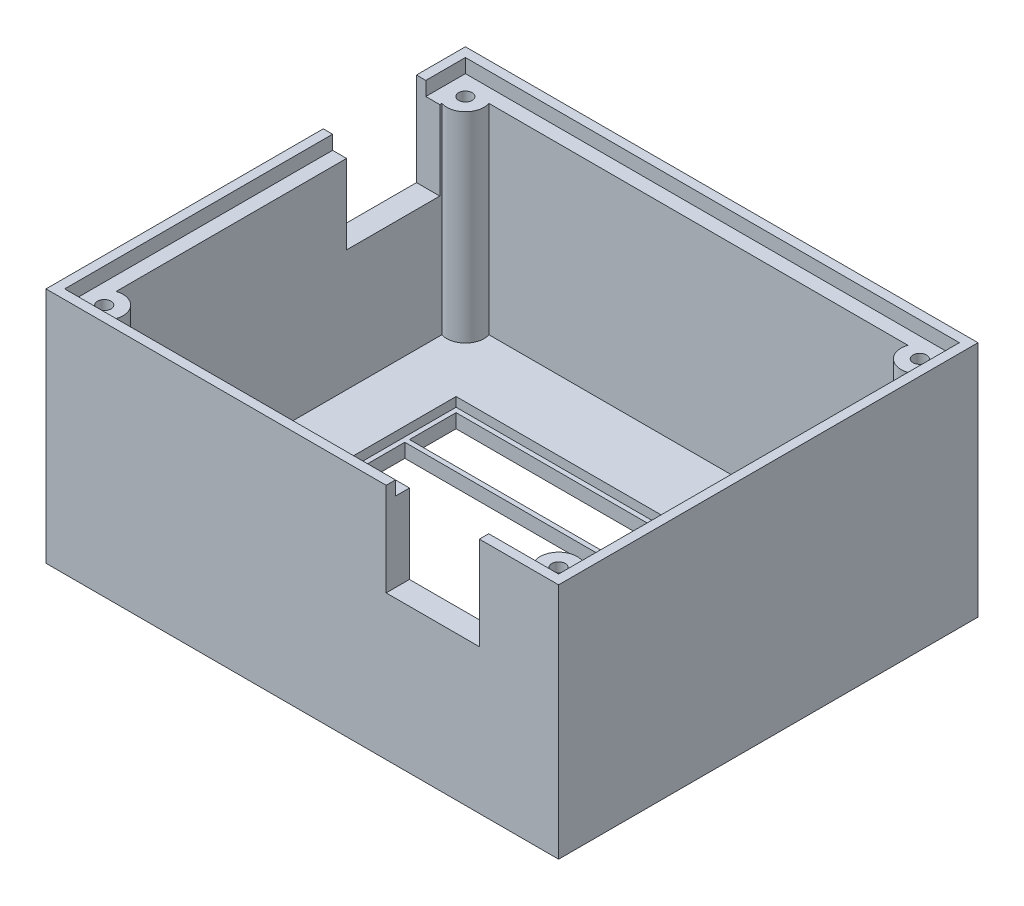
from build123d import *

# Parameters (mm, degrees)
SKETCH1_W                  = 110
SKETCH1_H                  = 90
BOSS_EXTRUDE1_DEPTH        = 51
SKETCH2_W                  = 100
SKETCH2_H                  = 80
CUT_EXTRUDE1_DEPTH         = 46
SKETCH3_W                  = 106
SKETCH3_H                  = 3
CUT_EXTRUDE2_DEPTH         = 3
SKETCH5_W                  = 3
SKETCH5_H                  = 83
CUT_EXTRUDE3_DEPTH         = 3
SKETCH6_W                  = 103
SKETCH6_H                  = 3
CUT_EXTRUDE4_DEPTH         = 3
SKETCH7_W                  = 3
SKETCH7_H                  = 80
CUT_EXTRUDE5_DEPTH         = 3
SKETCH9_R                  = 4
BOSS_EXTRUDE2_DEPTH        = 43
SKETCH10_R                 = 4
BOSS_EXTRUDE3_DEPTH        = 43
M2_5_CLEARANCE_HOLE1_D     = 2.9
M2_5_CLEARANCE_HOLE1_DEPTH = 5
M2_5_CLEARANCE_HOLE1_TIP   = 0.871247898
SKETCH14_W                 = 20
SKETCH14_H                 = 20
CUT_EXTRUDE6_DEPTH         = 5
SKETCH15_W                 = 20
SKETCH15_H                 = 20
CUT_EXTRUDE7_DEPTH         = 5
SKETCH16_W                 = 72
SKETCH16_H                 = 26
CUT_EXTRUDE8_DEPTH         = 5
SKETCH17_W                 = 72
SKETCH17_H                 = 10
CUT_EXTRUDE9_DEPTH         = 5
M6_CLEARANCE_HOLE2_D       = 6.6
SKETCH22_W                 = 74
SKETCH22_H                 = 39
CUT_EXTRUDE10_DEPTH        = 2


with BuildPart() as part:
    # Sketch1 → Boss-Extrude1 (new body)
    with BuildSketch(Plane(origin=(0, 0, 0), x_dir=(1, 0, 0), z_dir=(0, 1, 0))):
        Rectangle(SKETCH1_W, SKETCH1_H)
    extrude(amount=BOSS_EXTRUDE1_DEPTH)

    # Sketch2 → Cut-Extrude1 (cut)
    with BuildSketch(Plane(origin=(0, 51, 0), x_dir=(1, 0, 0), z_dir=(0, 1, 0))):
        Rectangle(SKETCH2_W, SKETCH2_H)
    extrude(amount=-CUT_EXTRUDE1_DEPTH, mode=Mode.SUBTRACT)

    # Sketch3 → Cut-Extrude2 (cut)
    with BuildSketch(Plane(origin=(0, 51, 0), x_dir=(1, 0, 0), z_dir=(0, 1, 0))):
        with Locations((0, 41.5)):
            Rectangle(SKETCH3_W, SKETCH3_H)
    extrude(amount=-CUT_EXTRUDE2_DEPTH, mode=Mode.SUBTRACT)

    # Sketch5 → Cut-Extrude3 (cut)
    with BuildSketch(Plane(origin=(0, 51, 0), x_dir=(1, 0, 0), z_dir=(0, 1, 0))):
        with Locations((51.5, -1.5)):
            Rectangle(SKETCH5_W, SKETCH5_H)
    extrude(amount=-CUT_EXTRUDE3_DEPTH, mode=Mode.SUBTRACT)

    # Sketch6 → Cut-Extrude4 (cut)
    with BuildSketch(Plane(origin=(0, 51, 0), x_dir=(1, 0, 0), z_dir=(0, 1, 0))):
        with Locations((-1.5, -41.5)):
            Rectangle(SKETCH6_W, SKETCH6_H)
    extrude(amount=-CUT_EXTRUDE4_DEPTH, mode=Mode.SUBTRACT)

    # Sketch7 → Cut-Extrude5 (cut)
    with BuildSketch(Plane(origin=(0, 51, 0), x_dir=(1, 0, 0), z_dir=(0, 1, 0))):
        with Locations((-51.5, 0)):
            Rectangle(SKETCH7_W, SKETCH7_H)
    extrude(amount=-CUT_EXTRUDE5_DEPTH, mode=Mode.SUBTRACT)

    # Sketch9 → Boss-Extrude2 (add)
    with BuildSketch(Plane(origin=(0, 5, 0), x_dir=(1, 0, 0), z_dir=(0, 1, 0))):
        with Locations((-48.75, 38.75)):
            Circle(SKETCH9_R)
    extrude(amount=BOSS_EXTRUDE2_DEPTH)

    # Sketch10 → Boss-Extrude3 (add)
    with BuildSketch(Plane(origin=(0, 5, 0), x_dir=(1, 0, 0), z_dir=(0, 1, 0))):
        with Locations((48.75, 38.75)):
            Circle(SKETCH10_R)
        with Locations((48.75, -38.75)):
            Circle(SKETCH10_R)
        with Locations((-48.75, -38.75)):
            Circle(SKETCH10_R)
    extrude(amount=BOSS_EXTRUDE3_DEPTH)

    # M2.5 Clearance Hole1
    with Locations(Plane(origin=(0, 48, 0), x_dir=(1, 0, 0), z_dir=(0, 1, 0))):
        with Locations((-48.75, 38.75), (48.75, 38.75), (48.75, -38.75), (-48.75, -38.75)):
            Hole(M2_5_CLEARANCE_HOLE1_D / 2, depth=M2_5_CLEARANCE_HOLE1_DEPTH)
            with Locations((0, 0, -(M2_5_CLEARANCE_HOLE1_DEPTH + M2_5_CLEARANCE_HOLE1_TIP / 2))):  # 118° drill point
                Cone(0, M2_5_CLEARANCE_HOLE1_D / 2, M2_5_CLEARANCE_HOLE1_TIP, mode=Mode.SUBTRACT)

    # Sketch14 → Cut-Extrude6 (cut)
    with BuildSketch(Plane.ZY.offset(55)):
        with Locations((-24.5, 41)):
            Rectangle(SKETCH14_W, SKETCH14_H)
    extrude(amount=-CUT_EXTRUDE6_DEPTH, mode=Mode.SUBTRACT)

    # Sketch15 → Cut-Extrude7 (cut)
    with BuildSketch(Plane.XY.offset(45)):
        with Locations((28, 41)):
            Rectangle(SKETCH15_W, SKETCH15_H)
    extrude(amount=-CUT_EXTRUDE7_DEPTH, mode=Mode.SUBTRACT)

    # Sketch16 → Cut-Extrude8 (cut)
    with BuildSketch(Plane(origin=(0, 5, 0), x_dir=(1, 0, 0), z_dir=(0, 1, 0))):
        Rectangle(SKETCH16_W, SKETCH16_H)
    extrude(amount=-CUT_EXTRUDE8_DEPTH, mode=Mode.SUBTRACT)

    # Sketch17 → Cut-Extrude9 (cut)
    with BuildSketch(Plane.XZ):
        with Locations((0, -19)):
            Rectangle(SKETCH17_W, SKETCH17_H)
    extrude(amount=-CUT_EXTRUDE9_DEPTH, mode=Mode.SUBTRACT)

    # M6 Clearance Hole2 (through all)
    with Locations(Plane(origin=(0, 0, 0), x_dir=(-1, 0, 0), z_dir=(0, -1, 0))):
        with Locations((40, -28)):
            Hole(M6_CLEARANCE_HOLE2_D / 2)

    # Sketch22 → Cut-Extrude10 (cut)
    with BuildSketch(Plane(origin=(0, 5, 0), x_dir=(1, 0, 0), z_dir=(0, 1, 0))):
        with Locations((0, 5.5)):
            Rectangle(SKETCH22_W, SKETCH22_H)
    extrude(amount=-CUT_EXTRUDE10_DEPTH, mode=Mode.SUBTRACT)


solid = part.part
